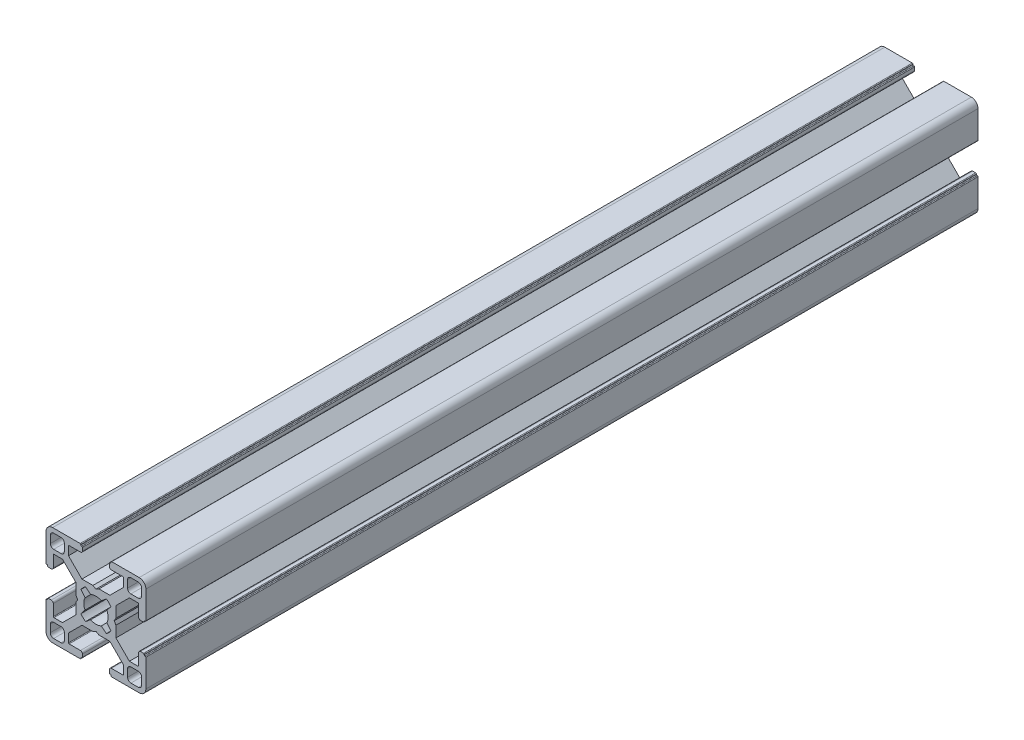
from build123d import *

# Parameters (mm, degrees)
BASE_EXTRUDE_DEPTH = 250


with BuildPart() as part:
    # Sketch1 → Base-Extrude (new body)
    with BuildSketch(Plane.XY):
        with BuildLine():
            Line((6.00446543, 0.899999619), (5.484852164, 0))
            Line((5.484852164, 0), (6.00446543, -0.899999619))
            Line((6.00446543, -0.899999619), (6.00446543, -4.204465866))
            Line((6.00446543, -4.204465866), (10.049999564, -8.25))
            Line((10.049999564, -8.25), (12.59999928, -8.25))
            ThreePointArc((12.59999928, -8.25), (12.741420837, -8.191421273), (12.799999564, -8.049999716))
            Line((12.799999564, -8.049999716), (12.799999564, -4.649999613))
            ThreePointArc((12.799999564, -4.649999613), (12.975735606, -4.225735278), (13.39999994, -4.049999237))
            Line((13.39999994, -4.049999237), (14.300000043, -4.049999237))
            ThreePointArc((14.300000043, -4.049999237), (14.4414216, -4.108577964), (14.500000327, -4.249999521))
            Line((14.500000327, -4.249999521), (14.500000327, -4.349998953))
            ThreePointArc((14.500000327, -4.349998953), (14.558579054, -4.49142051), (14.700000611, -4.549999237))
            Line((14.700000611, -4.549999237), (14.799999716, -4.549999237))
            ThreePointArc((14.799999716, -4.549999237), (14.941421273, -4.608577964), (15, -4.749999521))
            Line((15, -4.749999521), (15, -13.000000346))
            ThreePointArc((15, -13.000000346), (14.414213664, -14.414213664), (13.000000346, -15))
            Line((13.000000346, -15), (4.749999945, -15))
            ThreePointArc((4.749999945, -15), (4.60857832, -14.941421245), (4.549999564, -14.799999619))
            Line((4.549999564, -14.799999619), (4.549999564, -14.69999942))
            ThreePointArc((4.549999564, -14.69999942), (4.49142109, -14.558578474), (4.350000144, -14.5))
            Line((4.350000144, -14.5), (4.250000374, -14.5))
            ThreePointArc((4.250000374, -14.5), (4.108578753, -14.441421247), (4.05, -14.299999626))
            Line((4.05, -14.299999626), (4.05, -13.399999434))
            ThreePointArc((4.05, -13.399999434), (4.225735989, -12.975735226), (4.650000197, -12.799999237))
            Line((4.650000197, -12.799999237), (8.049999924, -12.799999237))
            ThreePointArc((8.049999924, -12.799999237), (8.191421565, -12.741420475), (8.250000327, -12.599998834))
            Line((8.250000327, -12.599998834), (8.250000327, -10.049999237))
            Line((8.250000327, -10.049999237), (4.204466193, -6))
            Line((4.204466193, -6), (0.899999946, -6))
            Line((0.899999946, -6), (0, -5.484851837))
            Line((0, -5.484851837), (-0.899999946, -6))
            Line((-0.899999946, -6), (-4.204466193, -6))
            Line((-4.204466193, -6), (-8.250000327, -10.049999237))
            Line((-8.250000327, -10.049999237), (-8.250000327, -12.599998834))
            ThreePointArc((-8.250000327, -12.599998834), (-8.191421565, -12.741420475), (-8.049999924, -12.799999237))
            Line((-8.049999924, -12.799999237), (-4.650000197, -12.799999237))
            ThreePointArc((-4.650000197, -12.799999237), (-4.225735989, -12.975735226), (-4.05, -13.399999434))
            Line((-4.05, -13.399999434), (-4.05, -14.299999626))
            ThreePointArc((-4.05, -14.299999626), (-4.108578753, -14.441421247), (-4.250000374, -14.5))
            Line((-4.250000374, -14.5), (-4.350000144, -14.5))
            ThreePointArc((-4.350000144, -14.5), (-4.49142109, -14.558578474), (-4.549999564, -14.69999942))
            Line((-4.549999564, -14.69999942), (-4.549999564, -14.799999619))
            ThreePointArc((-4.549999564, -14.799999619), (-4.60857832, -14.941421245), (-4.749999945, -15))
            Line((-4.749999945, -15), (-13.000000346, -15))
            ThreePointArc((-13.000000346, -15), (-14.414213664, -14.414213664), (-15, -13.000000346))
            Line((-15, -13.000000346), (-15, -4.749999521))
            ThreePointArc((-15, -4.749999521), (-14.941421273, -4.608577964), (-14.799999716, -4.549999237))
            Line((-14.799999716, -4.549999237), (-14.700000611, -4.549999237))
            ThreePointArc((-14.700000611, -4.549999237), (-14.558579054, -4.49142051), (-14.500000327, -4.349998953))
            Line((-14.500000327, -4.349998953), (-14.500000327, -4.249999521))
            ThreePointArc((-14.500000327, -4.249999521), (-14.4414216, -4.108577964), (-14.300000043, -4.049999237))
            Line((-14.300000043, -4.049999237), (-13.39999994, -4.049999237))
            ThreePointArc((-13.39999994, -4.049999237), (-12.975735606, -4.225735278), (-12.799999564, -4.649999613))
            Line((-12.799999564, -4.649999613), (-12.799999564, -8.049999716))
            ThreePointArc((-12.799999564, -8.049999716), (-12.741420837, -8.191421273), (-12.59999928, -8.25))
            Line((-12.59999928, -8.25), (-10.049999564, -8.25))
            Line((-10.049999564, -8.25), (-6.00446543, -4.204465866))
            Line((-6.00446543, -4.204465866), (-6.00446543, -0.899999619))
            Line((-6.00446543, -0.899999619), (-5.484852164, 0))
            Line((-5.484852164, 0), (-6.00446543, 0.899999619))
            Line((-6.00446543, 0.899999619), (-6.00446543, 4.204465866))
            Line((-6.00446543, 4.204465866), (-10.049999564, 8.25))
            Line((-10.049999564, 8.25), (-12.59999928, 8.25))
            ThreePointArc((-12.59999928, 8.25), (-12.741420837, 8.191421273), (-12.799999564, 8.049999716))
            Line((-12.799999564, 8.049999716), (-12.799999564, 4.649999613))
            ThreePointArc((-12.799999564, 4.649999613), (-12.975735606, 4.225735278), (-13.39999994, 4.049999237))
            Line((-13.39999994, 4.049999237), (-14.300000043, 4.049999237))
            ThreePointArc((-14.300000043, 4.049999237), (-14.4414216, 4.108577964), (-14.500000327, 4.249999521))
            Line((-14.500000327, 4.249999521), (-14.500000327, 4.349998953))
            ThreePointArc((-14.500000327, 4.349998953), (-14.558579054, 4.49142051), (-14.700000611, 4.549999237))
            Line((-14.700000611, 4.549999237), (-14.799999716, 4.549999237))
            ThreePointArc((-14.799999716, 4.549999237), (-14.941421273, 4.608577964), (-15, 4.749999521))
            Line((-15, 4.749999521), (-15, 13.000000346))
            ThreePointArc((-15, 13.000000346), (-14.414213664, 14.414213664), (-13.000000346, 15))
            Line((-13.000000346, 15), (-4.749999945, 15))
            ThreePointArc((-4.749999945, 15), (-4.60857832, 14.941421245), (-4.549999564, 14.799999619))
            Line((-4.549999564, 14.799999619), (-4.549999564, 14.69999942))
            ThreePointArc((-4.549999564, 14.69999942), (-4.49142109, 14.558578474), (-4.350000144, 14.5))
            Line((-4.350000144, 14.5), (-4.250000374, 14.5))
            ThreePointArc((-4.250000374, 14.5), (-4.108578753, 14.441421247), (-4.05, 14.299999626))
            Line((-4.05, 14.299999626), (-4.05, 13.399999434))
            ThreePointArc((-4.05, 13.399999434), (-4.225735989, 12.975735226), (-4.650000197, 12.799999237))
            Line((-4.650000197, 12.799999237), (-8.049999924, 12.799999237))
            ThreePointArc((-8.049999924, 12.799999237), (-8.191421565, 12.741420475), (-8.250000327, 12.599998834))
            Line((-8.250000327, 12.599998834), (-8.250000327, 10.049999237))
            Line((-8.250000327, 10.049999237), (-4.204466193, 6))
            Line((-4.204466193, 6), (-0.899999946, 6))
            Line((-0.899999946, 6), (0, 5.484851837))
            Line((0, 5.484851837), (0.899999946, 6))
            Line((0.899999946, 6), (4.204466193, 6))
            Line((4.204466193, 6), (8.250000327, 10.049999237))
            Line((8.250000327, 10.049999237), (8.250000327, 12.599998834))
            ThreePointArc((8.250000327, 12.599998834), (8.191421565, 12.741420475), (8.049999924, 12.799999237))
            Line((8.049999924, 12.799999237), (4.650000197, 12.799999237))
            ThreePointArc((4.650000197, 12.799999237), (4.225735989, 12.975735226), (4.05, 13.399999434))
            Line((4.05, 13.399999434), (4.05, 14.299999626))
            ThreePointArc((4.05, 14.299999626), (4.108578753, 14.441421247), (4.250000374, 14.5))
            Line((4.250000374, 14.5), (4.350000144, 14.5))
            ThreePointArc((4.350000144, 14.5), (4.49142109, 14.558578474), (4.549999564, 14.69999942))
            Line((4.549999564, 14.69999942), (4.549999564, 14.799999619))
            ThreePointArc((4.549999564, 14.799999619), (4.60857832, 14.941421245), (4.749999945, 15))
            Line((4.749999945, 15), (13.000000346, 15))
            ThreePointArc((13.000000346, 15), (14.414213664, 14.414213664), (15, 13.000000346))
            Line((15, 13.000000346), (15, 4.749999521))
            ThreePointArc((15, 4.749999521), (14.941421273, 4.608577964), (14.799999716, 4.549999237))
            Line((14.799999716, 4.549999237), (14.700000611, 4.549999237))
            ThreePointArc((14.700000611, 4.549999237), (14.558579054, 4.49142051), (14.500000327, 4.349998953))
            Line((14.500000327, 4.349998953), (14.500000327, 4.249999521))
            ThreePointArc((14.500000327, 4.249999521), (14.4414216, 4.108577964), (14.300000043, 4.049999237))
            Line((14.300000043, 4.049999237), (13.39999994, 4.049999237))
            ThreePointArc((13.39999994, 4.049999237), (12.975735606, 4.225735278), (12.799999564, 4.649999613))
            Line((12.799999564, 4.649999613), (12.799999564, 8.049999716))
            ThreePointArc((12.799999564, 8.049999716), (12.741420837, 8.191421273), (12.59999928, 8.25))
            Line((12.59999928, 8.25), (10.049999564, 8.25))
            Line((10.049999564, 8.25), (6.00446543, 4.204465866))
            Line((6.00446543, 4.204465866), (6.00446543, 0.899999619))
        make_face()
        with BuildLine():
            Line((13.70000109, 12.700000398), (13.70000109, 10.499999635))
            ThreePointArc((13.70000109, 10.499999635), (13.407107874, 9.792892851), (12.70000109, 9.499999635))
            Line((12.70000109, 9.499999635), (10.500000327, 9.499999635))
            ThreePointArc((10.500000327, 9.499999635), (9.792893543, 9.792892851), (9.500000327, 10.499999635))
            Line((9.500000327, 10.499999635), (9.500000327, 12.700000398))
            ThreePointArc((9.500000327, 12.700000398), (9.792893543, 13.407107182), (10.500000327, 13.700000398))
            Line((10.500000327, 13.700000398), (12.70000109, 13.700000398))
            ThreePointArc((12.70000109, 13.700000398), (13.407107874, 13.407107182), (13.70000109, 12.700000398))
        make_face(mode=Mode.SUBTRACT)
        with BuildLine():
            Line((3.135929412, 4.518400903), (1.600129524, 3.280561767))
            ThreePointArc((1.600129524, 3.280561767), (0, 3.65), (-1.600129524, 3.280561767))
            Line((-1.600129524, 3.280561767), (-3.135929412, 4.518400903))
            ThreePointArc((-3.135929412, 4.518400903), (-3.881002259, 3.897155561), (-4.505336892, 3.154669473))
            Line((-4.505336892, 3.154669473), (-3.280561732, 1.600129597))
            ThreePointArc((-3.280561732, 1.600129597), (-3.65, 0), (-3.280561732, -1.600129597))
            Line((-3.280561732, -1.600129597), (-4.505336892, -3.154669473))
            ThreePointArc((-4.505336892, -3.154669473), (-3.881002259, -3.897155561), (-3.135929412, -4.518400903))
            Line((-3.135929412, -4.518400903), (-1.600129524, -3.280561767))
            ThreePointArc((-1.600129524, -3.280561767), (0, -3.65), (1.600129524, -3.280561767))
            Line((1.600129524, -3.280561767), (3.135929412, -4.518400903))
            ThreePointArc((3.135929412, -4.518400903), (3.881002259, -3.897155561), (4.505336892, -3.154669473))
            Line((4.505336892, -3.154669473), (3.280561732, -1.600129597))
            ThreePointArc((3.280561732, -1.600129597), (3.65, 0), (3.280561732, 1.600129597))
            Line((3.280561732, 1.600129597), (4.505336892, 3.154669473))
            ThreePointArc((4.505336892, 3.154669473), (3.881002259, 3.897155561), (3.135929412, 4.518400903))
        make_face(mode=Mode.SUBTRACT)
        with BuildLine():
            Line((-13.70000109, -12.700000398), (-13.70000109, -10.499999635))
            ThreePointArc((-13.70000109, -10.499999635), (-13.407107874, -9.792892851), (-12.70000109, -9.499999635))
            Line((-12.70000109, -9.499999635), (-10.500000327, -9.499999635))
            ThreePointArc((-10.500000327, -9.499999635), (-9.792893543, -9.792892851), (-9.500000327, -10.499999635))
            Line((-9.500000327, -10.499999635), (-9.500000327, -12.700000398))
            ThreePointArc((-9.500000327, -12.700000398), (-9.792893543, -13.407107182), (-10.500000327, -13.700000398))
            Line((-10.500000327, -13.700000398), (-12.70000109, -13.700000398))
            ThreePointArc((-12.70000109, -13.700000398), (-13.407107874, -13.407107182), (-13.70000109, -12.700000398))
        make_face(mode=Mode.SUBTRACT)
        with BuildLine():
            Line((10.500000327, -13.700000398), (12.70000109, -13.700000398))
            ThreePointArc((12.70000109, -13.700000398), (13.407107874, -13.407107182), (13.70000109, -12.700000398))
            Line((13.70000109, -12.700000398), (13.70000109, -10.499999635))
            ThreePointArc((13.70000109, -10.499999635), (13.407107874, -9.792892851), (12.70000109, -9.499999635))
            Line((12.70000109, -9.499999635), (10.500000327, -9.499999635))
            ThreePointArc((10.500000327, -9.499999635), (9.792893543, -9.792892851), (9.500000327, -10.499999635))
            Line((9.500000327, -10.499999635), (9.500000327, -12.700000398))
            ThreePointArc((9.500000327, -12.700000398), (9.792893543, -13.407107182), (10.500000327, -13.700000398))
        make_face(mode=Mode.SUBTRACT)
        with BuildLine():
            Line((-10.500000327, 13.700000398), (-12.70000109, 13.700000398))
            ThreePointArc((-12.70000109, 13.700000398), (-13.407107874, 13.407107182), (-13.70000109, 12.700000398))
            Line((-13.70000109, 12.700000398), (-13.70000109, 10.499999635))
            ThreePointArc((-13.70000109, 10.499999635), (-13.407107874, 9.792892851), (-12.70000109, 9.499999635))
            Line((-12.70000109, 9.499999635), (-10.500000327, 9.499999635))
            ThreePointArc((-10.500000327, 9.499999635), (-9.792893543, 9.792892851), (-9.500000327, 10.499999635))
            Line((-9.500000327, 10.499999635), (-9.500000327, 12.700000398))
            ThreePointArc((-9.500000327, 12.700000398), (-9.792893543, 13.407107182), (-10.500000327, 13.700000398))
        make_face(mode=Mode.SUBTRACT)
    extrude(amount=-BASE_EXTRUDE_DEPTH)


solid = part.part
